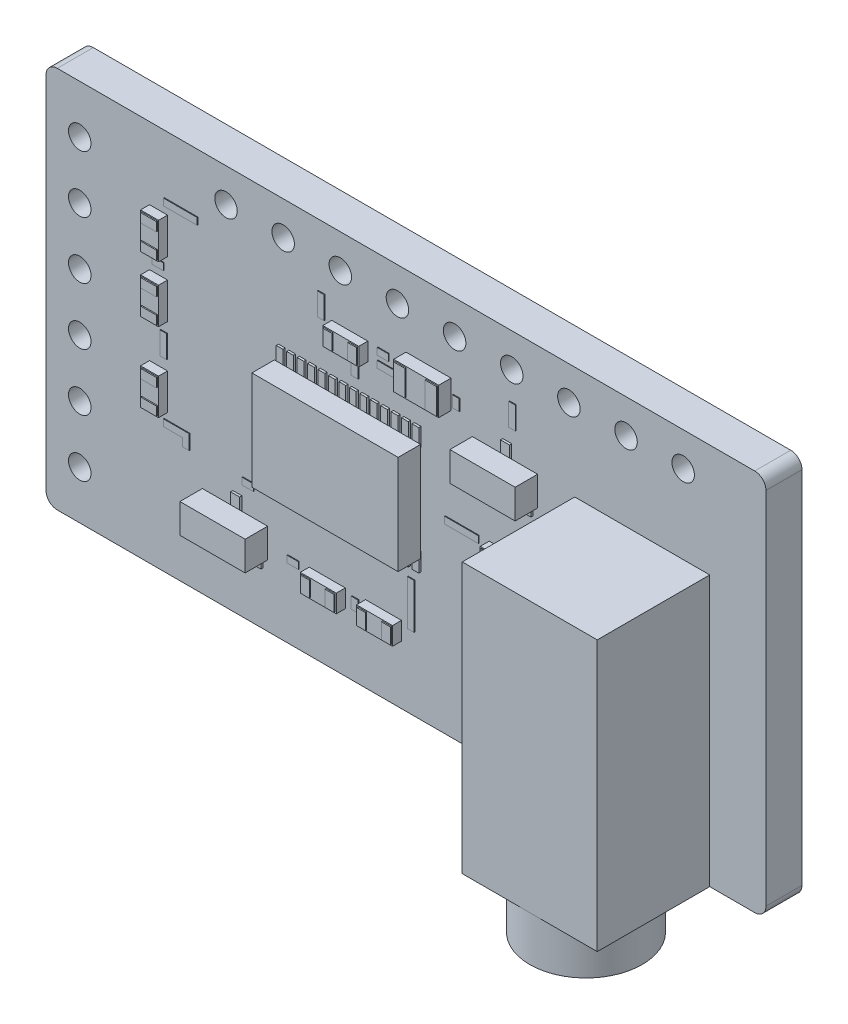
from build123d import *

# Parameters (mm, degrees)
PCB_DEPTH                    = 1.6
SKETCH2_W                    = 0.3
SKETCH2_H                    = 0.5
SKETCH2_H_2                  = 1
SKETCH2_W_2                  = 0.5
SKETCH2_H_3                  = 0.3
SKETCH2_W_3                  = 1.5
SKETCH2_W_4                  = 1
SKETCH2_H_4                  = 2
TRACKS_DEPTH                 = 0.035
SKETCH3_W                    = 0.3
SKETCH3_H                    = 0.8
SKETCH3_W_2                  = 0.4
SKETCH3_H_2                  = 0.7
SMD_ADD00_DEPTH              = 0.1
SKETCH4_W                    = 0.8
SKETCH4_H                    = 1.6
SKETCH4_W_2                  = 1.6
SKETCH4_H_2                  = 0.8
SMD_ADD01_DEPTH              = 0.4
SKETCH5_W                    = 2
SKETCH5_H                    = 1.25
SMD_ADD02_DEPTH              = 0.55
SKETCH6_W                    = 6.5
SKETCH6_H                    = 4.4
SKETCH6_W_2                  = 2.9
SKETCH6_H_2                  = 1.3
SMD_ADD03_DEPTH              = 1
SKETCH7_W                    = 0.7
SKETCH7_H                    = 0.4
SKETCH7_W_2                  = 0.4
SKETCH7_H_2                  = 0.7
SMD_ADD04_DEPTH              = 0.05
SKETCH8_W                    = 0.5
SKETCH8_H                    = 1.15
SMD_ADD05_DEPTH              = 0.05
SKETCH9_W                    = 6
SKETCH9_H                    = 12
BODY00_DEPTH                 = 5
SKETCH10_R                   = 2.5
SIDE0_J1_JACK_NOSE_DEPTH     = 2
SKETCH11_R                   = 1.75
SIDEBORE0_J1_JACK_NOSE_DEPTH = 2
SKETCH12_R                   = 0.5
HOLES_DEPTH                  = 1.6


with BuildPart() as part:
    # Sketch1 → PCB (new body)
    with BuildSketch(Plane.XY):
        with BuildLine():
            Line((0.5, 0), (31.5, 0))
            ThreePointArc((31.5, 0), (31.853553391, 0.146446609), (32, 0.5))
            Line((32, 0.5), (32, 16.5))
            ThreePointArc((32, 16.5), (31.853553391, 16.853553391), (31.5, 17))
            Line((31.5, 17), (0.5, 17))
            ThreePointArc((0.5, 17), (0.146446609, 16.853553391), (0, 16.5))
            Line((0, 16.5), (0, 0.5))
            ThreePointArc((0, 0.5), (0.146446609, 0.146446609), (0.5, 0))
        make_face()
    extrude(amount=PCB_DEPTH)

    # Sketch2 → Tracks (add)
    with BuildSketch(Plane.XY.offset(1.6)):
        with Locations((13.75, 12)):
            Rectangle(SKETCH2_W, SKETCH2_H)
        with Locations((20.75, 13.75)):
            Rectangle(SKETCH2_W, SKETCH2_H_2)
        with Locations((9, 5.25)):
            Rectangle(SKETCH2_W_2, SKETCH2_H_3)
        Polygon((5.25, 5.9), (6.4, 5.9), (6.4, 5.25), (6.1, 5.25), (6.1, 5.6), (5.25, 5.6), align=None)
        with Locations((5.25, 8.75)):
            Rectangle(SKETCH2_W, SKETCH2_H_2)
        with Locations((5, 11.75)):
            Rectangle(SKETCH2_W_2, SKETCH2_H_3)
        with Locations((6, 14.25)):
            Rectangle(SKETCH2_W_3, SKETCH2_H_3)
        with Locations((18.5, 8.25)):
            Rectangle(SKETCH2_W_3, SKETCH2_H_3)
        with Locations((22.25, 8.25)):
            Rectangle(SKETCH2_W_4, SKETCH2_H_3)
        with Locations((19.25, 6.75)):
            Rectangle(SKETCH2_W, SKETCH2_H_2)
        with Locations((21.75, 6.75)):
            Rectangle(SKETCH2_W, SKETCH2_H_2)
        with Locations((19.25, 4.75)):
            Rectangle(SKETCH2_W, SKETCH2_H_2)
        with Locations((21.75, 4.75)):
            Rectangle(SKETCH2_W, SKETCH2_H_2)
        with Locations((13.75, 3)):
            Rectangle(SKETCH2_W, SKETCH2_H)
        with Locations((16.25, 4.25)):
            Rectangle(SKETCH2_W, SKETCH2_H_4)
        with Locations((11, 3.25)):
            Rectangle(SKETCH2_W_2, SKETCH2_H_3)
        with Locations((12.25, 13.75)):
            Rectangle(SKETCH2_W, SKETCH2_H_2)
        with Locations((15, 13.25)):
            Rectangle(SKETCH2_W_2, SKETCH2_H_3)
        Polygon((15.9, 13.25), (15.9, 12.6), (14.75, 12.6), (14.75, 12.9), (15.6, 12.9), (15.6, 13.25), align=None)
        with Locations((18.25, 13)):
            Rectangle(SKETCH2_W, SKETCH2_H)
    extrude(amount=TRACKS_DEPTH)

    # Sketch3 → SMD_add00 (add)
    with BuildSketch(Plane.XY.offset(1.6)):
        with Locations((10.482142857, 6.1)):
            Rectangle(SKETCH3_W, SKETCH3_H)
        with Locations((10.946428571, 6.1)):
            Rectangle(SKETCH3_W, SKETCH3_H)
        with Locations((11.410714286, 6.1)):
            Rectangle(SKETCH3_W, SKETCH3_H)
        with Locations((11.875, 6.1)):
            Rectangle(SKETCH3_W, SKETCH3_H)
        with Locations((12.339285714, 6.1)):
            Rectangle(SKETCH3_W, SKETCH3_H)
        with Locations((12.803571429, 6.1)):
            Rectangle(SKETCH3_W, SKETCH3_H)
        with Locations((13.267857143, 6.1)):
            Rectangle(SKETCH3_W, SKETCH3_H)
        with Locations((13.732142857, 6.1)):
            Rectangle(SKETCH3_W, SKETCH3_H)
        with Locations((14.196428571, 6.1)):
            Rectangle(SKETCH3_W, SKETCH3_H)
        with Locations((14.660714286, 6.1)):
            Rectangle(SKETCH3_W, SKETCH3_H)
        with Locations((15.125, 6.1)):
            Rectangle(SKETCH3_W, SKETCH3_H)
        with Locations((15.589285714, 6.1)):
            Rectangle(SKETCH3_W, SKETCH3_H)
        with Locations((16.053571429, 6.1)):
            Rectangle(SKETCH3_W, SKETCH3_H)
        with Locations((16.517857143, 6.1)):
            Rectangle(SKETCH3_W, SKETCH3_H)
        with Locations((10.482142857, 10.9)):
            Rectangle(SKETCH3_W, SKETCH3_H)
        with Locations((10.946428571, 10.9)):
            Rectangle(SKETCH3_W, SKETCH3_H)
        with Locations((11.410714286, 10.9)):
            Rectangle(SKETCH3_W, SKETCH3_H)
        with Locations((11.875, 10.9)):
            Rectangle(SKETCH3_W, SKETCH3_H)
        with Locations((12.339285714, 10.9)):
            Rectangle(SKETCH3_W, SKETCH3_H)
        with Locations((12.803571429, 10.9)):
            Rectangle(SKETCH3_W, SKETCH3_H)
        with Locations((13.267857143, 10.9)):
            Rectangle(SKETCH3_W, SKETCH3_H)
        with Locations((13.732142857, 10.9)):
            Rectangle(SKETCH3_W, SKETCH3_H)
        with Locations((14.196428571, 10.9)):
            Rectangle(SKETCH3_W, SKETCH3_H)
        with Locations((14.660714286, 10.9)):
            Rectangle(SKETCH3_W, SKETCH3_H)
        with Locations((15.125, 10.9)):
            Rectangle(SKETCH3_W, SKETCH3_H)
        with Locations((15.589285714, 10.9)):
            Rectangle(SKETCH3_W, SKETCH3_H)
        with Locations((16.053571429, 10.9)):
            Rectangle(SKETCH3_W, SKETCH3_H)
        with Locations((16.517857143, 10.9)):
            Rectangle(SKETCH3_W, SKETCH3_H)
        with Locations((19.55, 10.7)):
            Rectangle(SKETCH3_W_2, SKETCH3_H_2)
        with Locations((21.45, 10.7)):
            Rectangle(SKETCH3_W_2, SKETCH3_H_2)
        with Locations((20.5, 12.3)):
            Rectangle(SKETCH3_W_2, SKETCH3_H_2)
        with Locations((7.55, 2.7)):
            Rectangle(SKETCH3_W_2, SKETCH3_H_2)
        with Locations((9.45, 2.7)):
            Rectangle(SKETCH3_W_2, SKETCH3_H_2)
        with Locations((8.5, 4.3)):
            Rectangle(SKETCH3_W_2, SKETCH3_H_2)
    extrude(amount=SMD_ADD00_DEPTH)

    # Sketch4 → SMD_add01 (add)
    with BuildSketch(Plane.XY.offset(1.6)):
        with Locations((5, 7)):
            Rectangle(SKETCH4_W, SKETCH4_H)
        with Locations((5, 10.5)):
            Rectangle(SKETCH4_W, SKETCH4_H)
        with Locations((5, 13)):
            Rectangle(SKETCH4_W, SKETCH4_H)
        with Locations((20.5, 8)):
            Rectangle(SKETCH4_W_2, SKETCH4_H_2)
        with Locations((20.5, 6)):
            Rectangle(SKETCH4_W_2, SKETCH4_H_2)
        with Locations((20.5, 4)):
            Rectangle(SKETCH4_W_2, SKETCH4_H_2)
        with Locations((15, 3)):
            Rectangle(SKETCH4_W_2, SKETCH4_H_2)
        with Locations((12.5, 3)):
            Rectangle(SKETCH4_W_2, SKETCH4_H_2)
        with Locations((13.5, 13)):
            Rectangle(SKETCH4_W_2, SKETCH4_H_2)
    extrude(amount=SMD_ADD01_DEPTH)

    # Sketch5 → SMD_add02 (add)
    with BuildSketch(Plane.XY.offset(1.6)):
        with Locations((17, 13.2)):
            Rectangle(SKETCH5_W, SKETCH5_H)
    extrude(amount=SMD_ADD02_DEPTH)

    # Sketch6 → SMD_add03 (add)
    with BuildSketch(Plane.XY.offset(1.7)):
        with Locations((13.5, 8.5)):
            Rectangle(SKETCH6_W, SKETCH6_H)
        with Locations((20.5, 11.5)):
            Rectangle(SKETCH6_W_2, SKETCH6_H_2)
        with Locations((8.5, 3.5)):
            Rectangle(SKETCH6_W_2, SKETCH6_H_2)
    extrude(amount=SMD_ADD03_DEPTH)

    # Sketch7 → SMD_add04 (add)
    with BuildSketch(Plane.XY.offset(2)):
        with Locations((5, 6.45)):
            Rectangle(SKETCH7_W, SKETCH7_H)
        with Locations((5, 7.55)):
            Rectangle(SKETCH7_W, SKETCH7_H)
        with Locations((5, 9.95)):
            Rectangle(SKETCH7_W, SKETCH7_H)
        with Locations((5, 11.05)):
            Rectangle(SKETCH7_W, SKETCH7_H)
        with Locations((5, 12.45)):
            Rectangle(SKETCH7_W, SKETCH7_H)
        with Locations((5, 13.55)):
            Rectangle(SKETCH7_W, SKETCH7_H)
        with Locations((19.95, 8)):
            Rectangle(SKETCH7_W_2, SKETCH7_H_2)
        with Locations((21.05, 8)):
            Rectangle(SKETCH7_W_2, SKETCH7_H_2)
        with Locations((19.95, 6)):
            Rectangle(SKETCH7_W_2, SKETCH7_H_2)
        with Locations((21.05, 6)):
            Rectangle(SKETCH7_W_2, SKETCH7_H_2)
        with Locations((19.95, 4)):
            Rectangle(SKETCH7_W_2, SKETCH7_H_2)
        with Locations((21.05, 4)):
            Rectangle(SKETCH7_W_2, SKETCH7_H_2)
        with Locations((14.45, 3)):
            Rectangle(SKETCH7_W_2, SKETCH7_H_2)
        with Locations((15.55, 3)):
            Rectangle(SKETCH7_W_2, SKETCH7_H_2)
        with Locations((11.95, 3)):
            Rectangle(SKETCH7_W_2, SKETCH7_H_2)
        with Locations((13.05, 3)):
            Rectangle(SKETCH7_W_2, SKETCH7_H_2)
        with Locations((12.95, 13)):
            Rectangle(SKETCH7_W_2, SKETCH7_H_2)
        with Locations((14.05, 13)):
            Rectangle(SKETCH7_W_2, SKETCH7_H_2)
    extrude(amount=SMD_ADD04_DEPTH)

    # Sketch8 → SMD_add05 (add)
    with BuildSketch(Plane.XY.offset(2.15)):
        with Locations((16.3, 13.2)):
            Rectangle(SKETCH8_W, SKETCH8_H)
        with Locations((17.7, 13.2)):
            Rectangle(SKETCH8_W, SKETCH8_H)
    extrude(amount=SMD_ADD05_DEPTH)

    # Sketch9 → Body00 (add)
    with BuildSketch(Plane.XY.offset(1.6)):
        with Locations((26.5, 6)):
            Rectangle(SKETCH9_W, SKETCH9_H)
    extrude(amount=BODY00_DEPTH)

    # Sketch10 → Side0_J1_jack_nose (add)
    with BuildSketch(Plane(origin=(0, 0, 0), x_dir=(1, 0, 0), z_dir=(0, 1, 0))):
        with Locations(Location((26.5, -4.1, 0), (0, 0, 270))):
            Circle(SKETCH10_R)
    extrude(amount=-SIDE0_J1_JACK_NOSE_DEPTH)

    # Sketch11 → SideBore0_J1_jack_nose (cut)
    with BuildSketch(Plane(origin=(0, 0, 0), x_dir=(1, 0, 0), z_dir=(0, 1, 0))):
        with Locations(Location((26.5, -4.1, 0), (0, 0, 270))):
            Circle(SKETCH11_R)
    extrude(amount=-SIDEBORE0_J1_JACK_NOSE_DEPTH, mode=Mode.SUBTRACT)

    # Sketch12 → Holes (cut)
    with BuildSketch(Plane.XY.offset(1.6)):
        with Locations((1.5, 2.15)):
            Circle(SKETCH12_R)
        with Locations((1.5, 4.69)):
            Circle(SKETCH12_R)
        with Locations((1.5, 7.23)):
            Circle(SKETCH12_R)
        with Locations((1.5, 9.77)):
            Circle(SKETCH12_R)
        with Locations((1.5, 12.31)):
            Circle(SKETCH12_R)
        with Locations((1.5, 14.85)):
            Circle(SKETCH12_R)
        with Locations((8, 15.5)):
            Circle(SKETCH12_R)
        with Locations((10.54, 15.5)):
            Circle(SKETCH12_R)
        with Locations((13.08, 15.5)):
            Circle(SKETCH12_R)
        with Locations((15.62, 15.5)):
            Circle(SKETCH12_R)
        with Locations((18.16, 15.5)):
            Circle(SKETCH12_R)
        with Locations((20.7, 15.5)):
            Circle(SKETCH12_R)
        with Locations((23.24, 15.5)):
            Circle(SKETCH12_R)
        with Locations((25.78, 15.5)):
            Circle(SKETCH12_R)
        with Locations((28.32, 15.5)):
            Circle(SKETCH12_R)
    extrude(amount=-HOLES_DEPTH, mode=Mode.SUBTRACT)


solid = part.part
